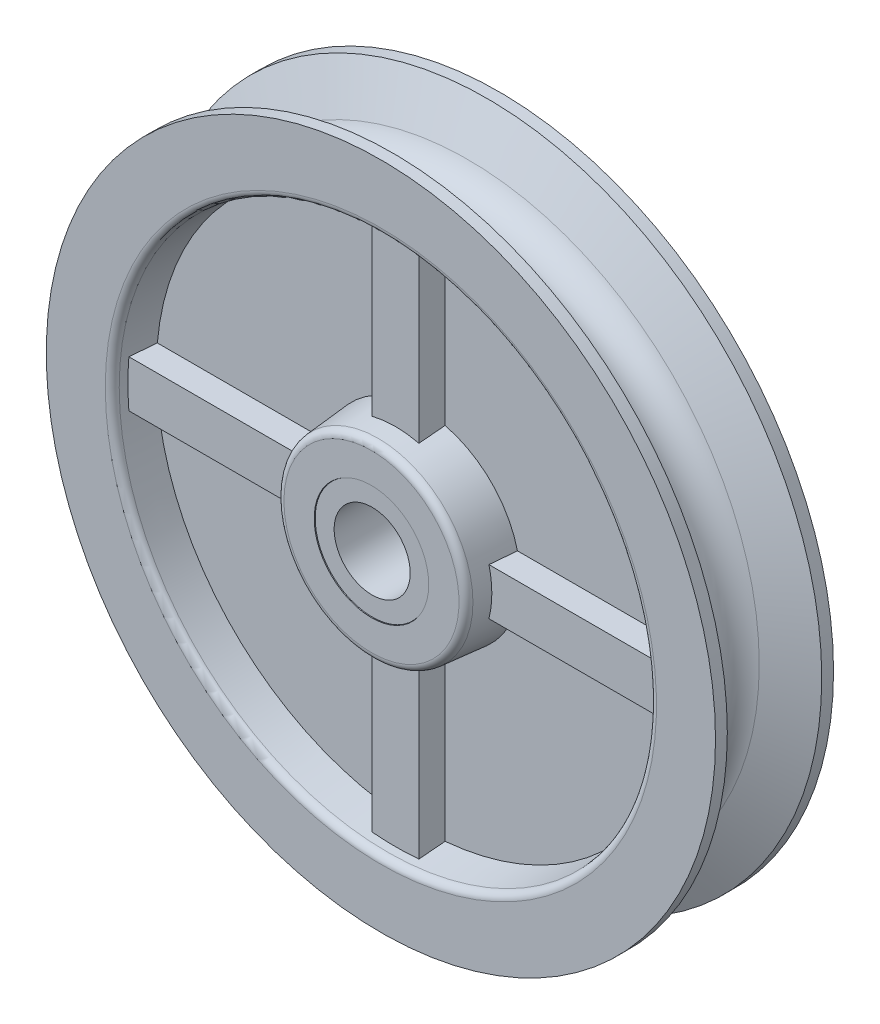
from build123d import *

# Parameters (mm, degrees)
CUT_EXTRUDE_THIN1_DEPTH      = 50.905354563
CUT_EXTRUDE_THIN1_DEPTH_BACK = 50.905354563
SKETCH2_R                    = 5.978525
SKETCH2_R_2                  = 5.953125
DRAFT1_ANGLE                 = 5
DRAFT2_ANGLE                 = 15
FILLET1_R                    = 0.762
SKETCH4_W                    = 4.8895
SKETCH4_H                    = 22.113875
EXTRUDE_THIN1_DEPTH          = 4.6355
CIRPATTERN1_COUNT            = 4


with BuildPart() as part:
    # Sketch1 → Revolve1 (revolve)
    with BuildSketch(Plane(origin=(0, 0, 0), x_dir=(0, 0, -1), z_dir=(1, 0, 0)), mode=Mode.PRIVATE) as revolve1_sk:
        with BuildLine():
            Line((4.9276, 34.925), (6.1595, 34.925))
            Line((6.1595, 34.925), (6.1595, 28.067))
            Line((6.1595, 28.067), (1.905, 28.067))
            Line((1.905, 28.067), (1.905, 9.921875))
            Line((1.905, 9.921875), (7.14375, 9.921875))
            Line((7.14375, 9.921875), (7.14375, 5.953125))
            Line((7.14375, 5.953125), (7.06755, 5.953125))
            Line((7.06755, 5.953125), (7.06755, 3.96875))
            Line((7.06755, 3.96875), (-7.06755, 3.96875))
            Line((-7.06755, 3.96875), (-7.06755, 5.953125))
            Line((-7.06755, 5.953125), (-7.14375, 5.953125))
            Line((-7.14375, 5.953125), (-7.14375, 9.921875))
            Line((-7.14375, 9.921875), (-1.905, 9.921875))
            Line((-1.905, 9.921875), (-1.905, 28.067))
            Line((-1.905, 28.067), (-6.1595, 28.067))
            Line((-6.1595, 28.067), (-6.1595, 34.925))
            Line((-6.1595, 34.925), (-4.9276, 34.925))
            Line((-4.9276, 34.925), (-2.891186797, 30.437878091))
            ThreePointArc((-2.891186797, 30.437878091), (0, 28.575), (2.891186797, 30.437878091))
            Line((2.891186797, 30.437878091), (4.9276, 34.925))
        make_face()
    revolve(revolve1_sk.sketch.rotate(Axis((0, 0, 7.14375), (0, 0, -1)), 90), axis=Axis((0, 0, 7.14375), (0, 0, -1)))

    # Sketch2 → Cut-Extrude-Thin1 (cut, two sides: drawn at the far end of the back side and taken through both)
    with BuildSketch(Plane.XY.offset(-CUT_EXTRUDE_THIN1_DEPTH_BACK)):
        Circle(SKETCH2_R)
        Circle(SKETCH2_R_2, mode=Mode.SUBTRACT)
    extrude(amount=CUT_EXTRUDE_THIN1_DEPTH + CUT_EXTRUDE_THIN1_DEPTH_BACK, mode=Mode.SUBTRACT)


with BuildPart() as cut_extrude_thin1_piece_1:
    # of the separate pieces the step leaves, piece 1, a body of its own (cut_extrude_thin1_pieces)
    add(part.part.solids().sort_by_distance((30.437878091, 0, -2.891186797))[0])

    # Draft1
    draft1_faces = [cut_extrude_thin1_piece_1.faces().sort_by_distance(p)[0] for p in [
        (-9.921875, 0, 4.524375),
        (-28.067, 0, 4.03225),
    ]]
    draft(draft1_faces, Plane(origin=(0, 28.067, 6.1595), x_dir=(1, 0, 0), z_dir=(0, 0, 1)), DRAFT1_ANGLE)

    # Draft2
    draft2_faces = [cut_extrude_thin1_piece_1.faces().sort_by_distance(p)[0] for p in [
        (-9.921875, 0, -4.524375),
        (-28.067, 0, -4.03225),
    ]]
    draft(draft2_faces, Plane(origin=(0, 34.925, -6.1595), x_dir=(-1, 0, 0), z_dir=(0, 0, -1)), DRAFT2_ANGLE)

    # Fillet1
    fillet1_edges = [cut_extrude_thin1_piece_1.edges().sort_by_distance(p)[0] for p in [
        (-28.067, 0, 6.1595),
        (-9.835764283, 0, 7.14375),
        (-9.658146007, 0, -7.14375),
        (-28.067, 0, -6.1595),
    ]]
    fillet(fillet1_edges, radius=FILLET1_R)



with BuildPart() as cut_extrude_thin1_piece_2:
    # of the separate pieces the step leaves, piece 2, a body of its own (cut_extrude_thin1_pieces)
    add(part.part.solids().sort_by_distance((5.953125, 0, -7.06755))[0])


with BuildPart() as cut_extrude_thin1_piece_1_1:
    add(cut_extrude_thin1_piece_1.part)

    add(cut_extrude_thin1_piece_2.part)  # Extrude-Thin1 merges Cut-Extrude-Thin1 piece 2
    # Sketch4 → Extrude-Thin1 (add, symmetric)
    with BuildSketch(Plane.XY):
        with Locations((0, 17.0100625)):
            Rectangle(SKETCH4_W, SKETCH4_H)
    extrude_thin1 = extrude(amount=EXTRUDE_THIN1_DEPTH, both=True)

    # CirPattern1: Extrude-Thin1 ×4 about axis
    cirpattern1_axis = Axis((0, 0, 0), (0, 0, 1))
    for i in range(1, CIRPATTERN1_COUNT):
        add(extrude_thin1.rotate(cirpattern1_axis, i * 360 / CIRPATTERN1_COUNT))


solid = cut_extrude_thin1_piece_1_1.part
